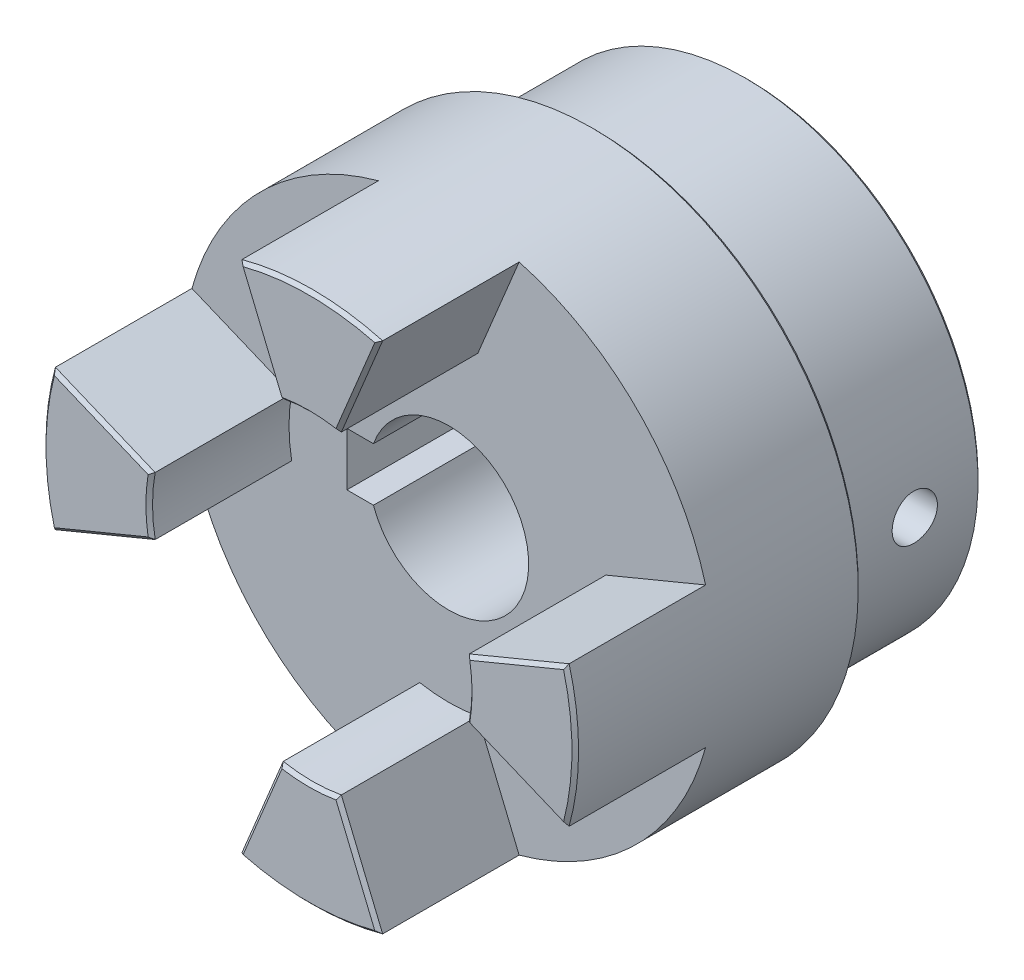
from build123d import *

# Parameters (mm, degrees)
BOSS_EXTRUDE1_DEPTH = 21
CIRPATTERN1_COUNT   = 4
CHAMFER1_SIZE       = 0.5
SKETCH4_W           = 6.599999999999998
SKETCH4_H           = 8
CUT_EXTRUDE1_DEPTH  = 73.2841614740048
CHAMFER2_SIZE       = 0.5
FILLET1_R           = 1
CIRPATTERN4_COUNT   = 4


with BuildPart() as part:
    # Sketch1 → Revolve1 (revolve)
    with BuildSketch(Plane(origin=(0, 0, 0), x_dir=(0, 0, -1), z_dir=(1, 0, 0))):
        Polygon((-7.9e-16, 35), (0, 11.999999999999998), (-45, 11.999999999999995), (-45, 39.999999999999986), (-23, 39.99999999999999), (-23, 35), align=None)
    revolve(axis=Axis((0, 0, 0), (0, -1.2e-16, 1)))

    # Sketch3 → Boss-Extrude1 (add)
    with BuildSketch(Plane.XY.offset(44.99999999999999)):
        with BuildLine():
            ThreePointArc((-4.365000000000001, 23.599719807658744), (-2.1916574340201906, 23.89972045217066), (-3.535e-13, 24.00000000000001))
            Line((0, 24.00000000000001), (0, 40))
            ThreePointArc((1.49969e-12, 40), (-5.332266542852567, 39.642993498422584), (-10.569350394509474, 38.578346675798365))
            Line((-10.569350394509476, 38.57834667579836), (-4.365, 23.599719807658744))
        make_face()
        with BuildLine():
            Line((0, 40), (0, 24.00000000000001))
            ThreePointArc((-3.5261e-13, 24.00000000000001), (2.191657434019837, 23.89972045217069), (4.365, 23.599719807658744))
            Line((4.365, 23.599719807658744), (10.569350394509485, 38.57834667579835))
            ThreePointArc((10.569350394509485, 38.57834667579835), (5.332266542854057, 39.64299349842238), (1.49969e-12, 40))
        make_face()
    boss_extrude1 = extrude(amount=BOSS_EXTRUDE1_DEPTH)

    # CirPattern1: Boss-Extrude1 ×4 about axis
    cirpattern1_axis = Axis((6e-17, -4.97e-15, 0), (0, 0, 1))
    for i in range(1, CIRPATTERN1_COUNT):
        add(boss_extrude1.rotate(cirpattern1_axis, i * 360 / CIRPATTERN1_COUNT))

    # Chamfer1
    chamfer1_edges = [part.edges().sort_by_distance(p)[0] for p in [
        (4.4e-16, 24.000000000000004, 66),
        (-7.467175197254738, 31.089033241728544, 66),
        (7.467175197254742, 31.08903324172854, 66),
        (9.77e-15, 39.999999999999986, 66),
        (24.000000000000007, -1.068e-14, 66),
        (31.08903324172855, 7.467175197254726, 66),
        (31.089033241728547, -7.467175197254755, 66),
        (39.99999999999999, -2.356e-14, 66),
        (-3.26e-15, -24.000000000000014, 66),
        (7.467175197254734, -31.089033241728554, 66),
        (-7.467175197254746, -31.08903324172855, 66),
        (-1.455e-14, -39.99999999999999, 66),
        (-24.000000000000007, -1.92e-15, 66),
        (-31.08903324172855, -7.46717519725474, 66),
        (-31.089033241728547, 7.467175197254741, 66),
        (-39.99999999999999, 9.18e-15, 66),
    ]]
    chamfer(chamfer1_edges, length=CHAMFER1_SIZE)

    # Sketch4 → Cut-Extrude1 (cut, through all)
    with BuildSketch(Plane.XY.offset(44.99999999999999)):
        with Locations((-12.000000000000002, 0)):
            Rectangle(SKETCH4_W, SKETCH4_H)
    extrude(amount=-CUT_EXTRUDE1_DEPTH, mode=Mode.SUBTRACT)

    # Chamfer2
    chamfer2_edges = [part.edges().sort_by_distance(p)[0] for p in [
        (-4.9e-15, -39.99999999999999, 22.999999999999993),
        (-4.29e-15, -35, -7.95e-15),
    ]]
    chamfer(chamfer2_edges, length=CHAMFER2_SIZE)

    # Fillet1
    fillet1_edges = [part.edges().sort_by_distance(p)[0] for p in [
        (-4.29e-15, -35, 22.999999999999993),
    ]]
    fillet(fillet1_edges, radius=FILLET1_R)

    # Sketch6 → M8x1.25 Tapped Hole1 (revolve, cut)
    with BuildSketch(Plane(origin=(0, 0, 10), x_dir=(0, 0, 1), z_dir=(0, 1, 0))):
        Polygon((0, 0), (-9.8e-15, 39.99999999999999), (3.3999999999999946, 39.99999999999999), (3.3999999999999995, 3.6e-16), align=None)
    m8x1_25_tapped_hole1 = revolve(axis=Axis((-6.349999999999991, 0, 10), (1, 0, 0)), mode=Mode.SUBTRACT)

    # CirPattern4: M8x1.25 Tapped Hole1 ×4 about axis, 2 skipped
    cirpattern4_axis = Axis((0, 0, 0), (0, -1.2e-16, 1))
    add([m8x1_25_tapped_hole1.rotate(cirpattern4_axis, i * 360 / CIRPATTERN4_COUNT) for i in range(1, CIRPATTERN4_COUNT) if i not in (1, 2)], mode=Mode.SUBTRACT)


solid = part.part
